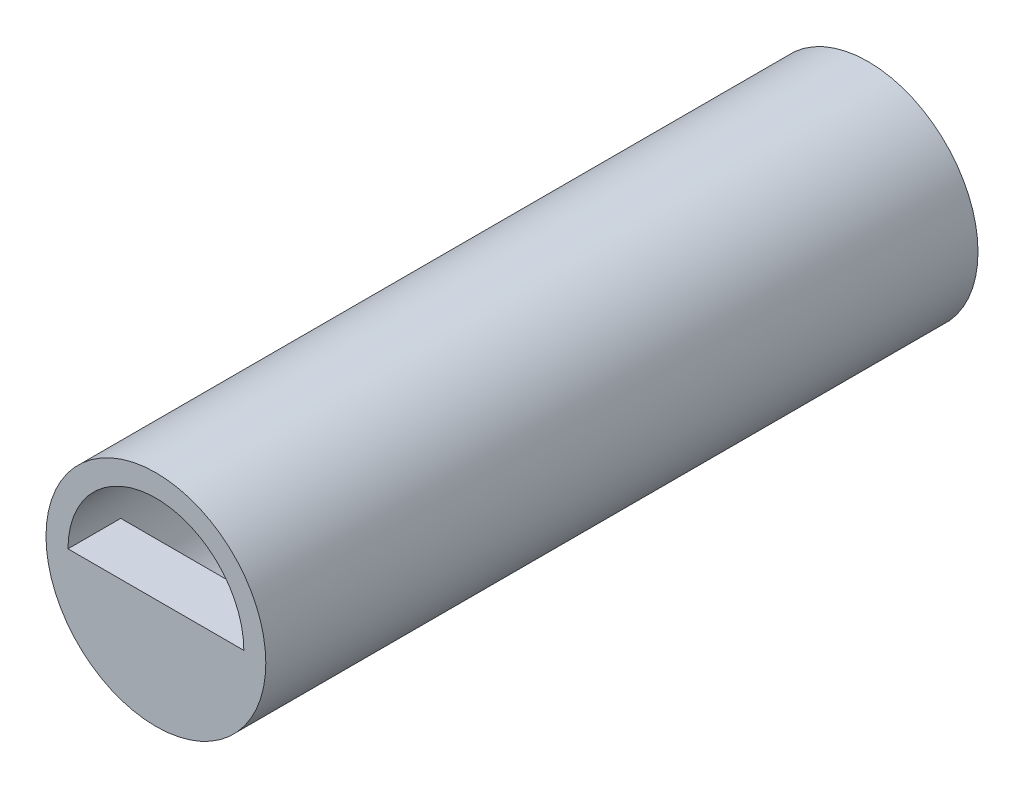
from build123d import *
from build123d.topology import SkipClean

# Parameters (mm, degrees)
CROQUIS1_R              = 2.5
CROQUIS1_R_2            = 2
SALIENTE_EXTRUIR1_DEPTH = 15
CROQUIS2_R              = 2.5
SALIENTE_EXTRUIR2_DEPTH = 1.2
CORTAR_EXTRUIR1_START   = -1.2
CORTAR_EXTRUIR1_DEPTH   = 1.2


with BuildPart() as part:
    # Croquis1 → Saliente-Extruir1 (new body)
    with BuildSketch(Plane.XY):
        Circle(CROQUIS1_R)
        Circle(CROQUIS1_R_2, mode=Mode.SUBTRACT)
    extrude(amount=SALIENTE_EXTRUIR1_DEPTH)

    # Croquis2 → Saliente-Extruir2 (add)
    with BuildSketch(Plane.XY.offset(15)):
        Circle(CROQUIS2_R)
    extrude(amount=SALIENTE_EXTRUIR2_DEPTH)

    # Croquis3 → Cortar-Extruir1 (cut)
    with SkipClean():  # the faces are left unmerged after this step: merging them gives an invalid solid
        with BuildSketch(Plane.XY.offset(16.2).offset(CORTAR_EXTRUIR1_START)):
            with BuildLine():
                Line((2, 0), (-2, 0))
                ThreePointArc((-2, 0), (0, 2), (2, 0))
            make_face()
        extrude(amount=CORTAR_EXTRUIR1_DEPTH, mode=Mode.SUBTRACT)


solid = part.part
